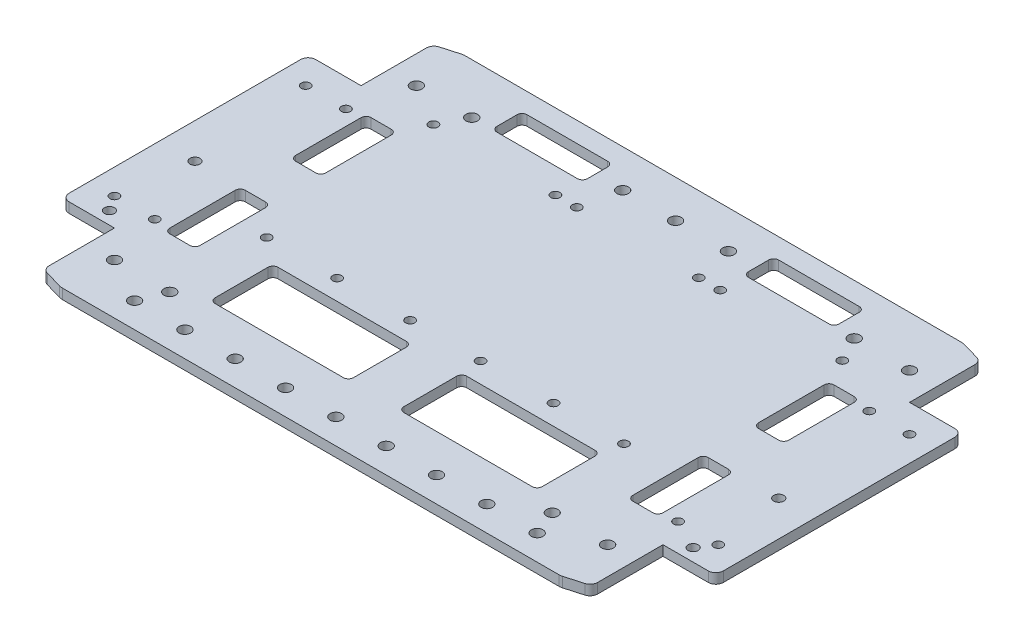
from build123d import *

# Parameters (mm, degrees)
BOSS_EXTRU_1_DEPTH         = 4
ENL_V_MAT_EXTRU_6_REACH    = 161.581
ESQUISSE15_R               = 2.3
ENL_V_MAT_EXTRU_10_REACH   = 161.581
SYM_TRIE8_COPY_1_REACH     = 161.581
ENL_V_MAT_EXTRU_12_REACH   = 161.581
ESQUISSE26_W               = 5
ESQUISSE26_H               = 98
CONG_2_R                   = 3
CONG_3_R                   = 5
ENL_V_MAT_EXTRU_16_REACH   = 154.696
ESQUISSE32_R               = 2.3
SYM_TRIE11_COPY_1_REACH    = 154.696
SYM_TRIE11_COPY_1_SKETCH_R = 2.3
ENL_V_MAT_EXTRU_17_REACH   = 154.696
ESQUISSE33_R               = 2
ENL_V_MAT_EXTRU_18_REACH   = 154.696
ESQUISSE34_R               = 2.3
ENL_V_MAT_EXTRU_21_REACH   = 154.696
ESQUISSE37_R               = 2.3
ENL_V_MAT_EXTRU_22_REACH   = 154.696
ESQUISSE39_R               = 1.8
ENL_V_MAT_EXTRU_23_REACH   = 154.696
ESQUISSE40_R               = 1.8
ENL_V_MAT_EXTRU_24_REACH   = 154.696
ESQUISSE38_W               = 55
ESQUISSE38_H               = 25
ENL_V_MAT_EXTRU_25_REACH   = 154.696
ESQUISSE41_W               = 12
ESQUISSE41_H               = 30
CONG_4_R                   = 2
ENL_V_MAT_EXTRU_26_REACH   = 154.696
CONG_5_R                   = 2


with BuildPart() as part:
    # Esquisse1 → Boss.-Extru.1 (new body)
    with BuildSketch(Plane(origin=(0, 0, 0), x_dir=(1, 0, 0), z_dir=(0, 1, 0))):
        Polygon((-135, 0), (-135, -75), (-100, -85), (0, -85), (100, -85), (135, -75), (135, 0), (135, 75), (100, 85), (0, 85), (-100, 85), (-135, 75), align=None)
    extrude(amount=BOSS_EXTRU_1_DEPTH)

    # Esquisse15 → Enlèv. mat.-Extru.6 (cut, up to next)
    with BuildSketch(Plane(origin=(0, 4, 0), x_dir=(1, 0, 0), z_dir=(0, 1, 0)), mode=Mode.PRIVATE) as enl_v_mat_extru_6_sk1:
        with Locations(Location((-120, -60, 0), (0, 0, 270))):
            Circle(ESQUISSE15_R)
    enl_v_mat_extru_6_tool1 = extrude(enl_v_mat_extru_6_sk1.sketch, amount=-ENL_V_MAT_EXTRU_6_REACH, mode=Mode.PRIVATE) & part.part
    # Esquisse15 → Enlèv. mat.-Extru.6 (cut, up to next)
    with BuildSketch(Plane(origin=(0, 4, 0), x_dir=(1, 0, 0), z_dir=(0, 1, 0)), mode=Mode.PRIVATE) as enl_v_mat_extru_6_sk2:
        with Locations(Location((-120, 60, 0), (0, 0, 270))):
            Circle(ESQUISSE15_R)
    enl_v_mat_extru_6_tool2 = extrude(enl_v_mat_extru_6_sk2.sketch, amount=-ENL_V_MAT_EXTRU_6_REACH, mode=Mode.PRIVATE) & part.part
    enl_v_mat_extru_6_1 = enl_v_mat_extru_6_tool1.solids().sort_by_distance((-120, 4, 60))[0]
    add(enl_v_mat_extru_6_1, mode=Mode.SUBTRACT)
    enl_v_mat_extru_6_2 = enl_v_mat_extru_6_tool2.solids().sort_by_distance((-120, 4, -60))[0]
    add(enl_v_mat_extru_6_2, mode=Mode.SUBTRACT)
    enl_v_mat_extru_6 = enl_v_mat_extru_6_1 + enl_v_mat_extru_6_2  # Enlèv. mat.-Extru.6 as one shape, for the pattern or mirror that repeats it

    # Symétrie5: Enlèv. mat.-Extru.6 across plane
    add(enl_v_mat_extru_6.mirror(Plane(origin=(0, 0, 0), x_dir=(0, 0, 1), z_dir=(1, 0, 0))), mode=Mode.SUBTRACT)

    # Esquisse20 → Enlèv. mat.-Extru.10 (cut, up to next)
    with BuildSketch(Plane(origin=(0, 4, 0), x_dir=(1, 0, 0), z_dir=(0, 1, 0)), mode=Mode.PRIVATE) as enl_v_mat_extru_10_sk1:
        Polygon((-109, -60), (-109, -82.428571429), (-135, -75), (-135, -49), (-109, -49), align=None)
    enl_v_mat_extru_10_tool1 = extrude(enl_v_mat_extru_10_sk1.sketch, amount=-ENL_V_MAT_EXTRU_10_REACH, mode=Mode.PRIVATE) & part.part
    enl_v_mat_extru_10 = enl_v_mat_extru_10_tool1.solids().sort_by_distance((-121.458333, 4, 63.934524))[0]
    add(enl_v_mat_extru_10, mode=Mode.SUBTRACT)

    # Symétrie7: Enlèv. mat.-Extru.10 across plane
    add(enl_v_mat_extru_10.mirror(Plane(origin=(0, 0, 0), x_dir=(0, 0, 1), z_dir=(1, 0, 0))), mode=Mode.SUBTRACT)

    # Symétrie8: Enlèv. mat.-Extru.10 across plane
    add(enl_v_mat_extru_10.mirror(Plane.XY), mode=Mode.SUBTRACT)

    # Symétrie8 copy 1 sketch → Symétrie8 copy 1 (cut, up to next)
    with BuildSketch(Plane(origin=(0, 4, 0), x_dir=(-1, 0, 0), z_dir=(0, 1, 0)), mode=Mode.PRIVATE) as sym_trie8_copy_1_sk1:
        Polygon((-109, -60), (-109, -82.428571429), (-135, -75), (-135, -49), (-109, -49), align=None)
    sym_trie8_copy_1_tool1 = extrude(sym_trie8_copy_1_sk1.sketch, amount=-SYM_TRIE8_COPY_1_REACH, mode=Mode.PRIVATE) & part.part
    add(sym_trie8_copy_1_tool1.solids().sort_by_distance((121.458333, 4, -63.934524))[0], mode=Mode.SUBTRACT)

    # Esquisse26 → Enlèv. mat.-Extru.12 (cut, up to next)
    with BuildSketch(Plane(origin=(0, 4, 0), x_dir=(1, 0, 0), z_dir=(0, 1, 0)), mode=Mode.PRIVATE) as enl_v_mat_extru_12_sk1:
        Polygon((-100, -80), (-99.299725277, -80), (-107.626394361, -77.62095169), (-109, -82.428571429), (-100, -85), align=None)
    enl_v_mat_extru_12_tool1 = extrude(enl_v_mat_extru_12_sk1.sketch, amount=-ENL_V_MAT_EXTRU_12_REACH, mode=Mode.PRIVATE) & part.part
    # Esquisse26 → Enlèv. mat.-Extru.12 (cut, up to next)
    with BuildSketch(Plane(origin=(0, 4, 0), x_dir=(1, 0, 0), z_dir=(0, 1, 0)), mode=Mode.PRIVATE) as enl_v_mat_extru_12_sk2:
        Polygon((-109, -82.428571429), (-107.626394361, -77.62095169), (-109, -77.228492936), align=None)
    enl_v_mat_extru_12_tool2 = extrude(enl_v_mat_extru_12_sk2.sketch, amount=-ENL_V_MAT_EXTRU_12_REACH, mode=Mode.PRIVATE) & part.part
    # Esquisse26 → Enlèv. mat.-Extru.12 (cut, up to next)
    with BuildSketch(Plane(origin=(0, 4, 0), x_dir=(1, 0, 0), z_dir=(0, 1, 0)), mode=Mode.PRIVATE) as enl_v_mat_extru_12_sk3:
        Polygon((98.626394361, -80.192380262), (99.299725277, -80), (-99.299725277, -80), (-98.626394361, -80.192380262), (-100, -85), (100, -85), align=None)
    enl_v_mat_extru_12_tool3 = extrude(enl_v_mat_extru_12_sk3.sketch, amount=-ENL_V_MAT_EXTRU_12_REACH, mode=Mode.PRIVATE) & part.part
    # Esquisse26 → Enlèv. mat.-Extru.12 (cut, up to next)
    with BuildSketch(Plane(origin=(0, 4, 0), x_dir=(1, 0, 0), z_dir=(0, 1, 0)), mode=Mode.PRIVATE) as enl_v_mat_extru_12_sk4:
        Polygon((109, -82.428571429), (107.626394361, -77.62095169), (99.299725277, -80), (100, -80), (100, -85), align=None)
    enl_v_mat_extru_12_tool4 = extrude(enl_v_mat_extru_12_sk4.sketch, amount=-ENL_V_MAT_EXTRU_12_REACH, mode=Mode.PRIVATE) & part.part
    # Esquisse26 → Enlèv. mat.-Extru.12 (cut, up to next)
    with BuildSketch(Plane(origin=(0, 4, 0), x_dir=(1, 0, 0), z_dir=(0, 1, 0)), mode=Mode.PRIVATE) as enl_v_mat_extru_12_sk5:
        Polygon((100, -80), (99.299725277, -80), (98.626394361, -80.192380262), (100, -85), align=None)
    enl_v_mat_extru_12_tool5 = extrude(enl_v_mat_extru_12_sk5.sketch, amount=-ENL_V_MAT_EXTRU_12_REACH, mode=Mode.PRIVATE) & part.part
    # Esquisse26 → Enlèv. mat.-Extru.12 (cut, up to next)
    with BuildSketch(Plane(origin=(0, 4, 0), x_dir=(1, 0, 0), z_dir=(0, 1, 0)), mode=Mode.PRIVATE) as enl_v_mat_extru_12_sk6:
        Polygon((109, -82.428571429), (109, -77.228492936), (107.626394361, -77.62095169), align=None)
    enl_v_mat_extru_12_tool6 = extrude(enl_v_mat_extru_12_sk6.sketch, amount=-ENL_V_MAT_EXTRU_12_REACH, mode=Mode.PRIVATE) & part.part
    # Esquisse26 → Enlèv. mat.-Extru.12 (cut, up to next)
    with BuildSketch(Plane(origin=(0, 4, 0), x_dir=(1, 0, 0), z_dir=(0, 1, 0)), mode=Mode.PRIVATE) as enl_v_mat_extru_12_sk7:
        with Locations((132.5, 0)):
            Rectangle(ESQUISSE26_W, ESQUISSE26_H)
    enl_v_mat_extru_12_tool7 = extrude(enl_v_mat_extru_12_sk7.sketch, amount=-ENL_V_MAT_EXTRU_12_REACH, mode=Mode.PRIVATE) & part.part
    # Esquisse26 → Enlèv. mat.-Extru.12 (cut, up to next)
    with BuildSketch(Plane(origin=(0, 4, 0), x_dir=(1, 0, 0), z_dir=(0, 1, 0)), mode=Mode.PRIVATE) as enl_v_mat_extru_12_sk8:
        Polygon((107.626394361, 77.62095169), (109, 82.428571429), (100, 85), (100, 80), (99.299725277, 80), align=None)
    enl_v_mat_extru_12_tool8 = extrude(enl_v_mat_extru_12_sk8.sketch, amount=-ENL_V_MAT_EXTRU_12_REACH, mode=Mode.PRIVATE) & part.part
    # Esquisse26 → Enlèv. mat.-Extru.12 (cut, up to next)
    with BuildSketch(Plane(origin=(0, 4, 0), x_dir=(1, 0, 0), z_dir=(0, 1, 0)), mode=Mode.PRIVATE) as enl_v_mat_extru_12_sk9:
        Polygon((107.626394361, 77.62095169), (109, 77.228492936), (109, 82.428571429), align=None)
    enl_v_mat_extru_12_tool9 = extrude(enl_v_mat_extru_12_sk9.sketch, amount=-ENL_V_MAT_EXTRU_12_REACH, mode=Mode.PRIVATE) & part.part
    # Esquisse26 → Enlèv. mat.-Extru.12 (cut, up to next)
    with BuildSketch(Plane(origin=(0, 4, 0), x_dir=(1, 0, 0), z_dir=(0, 1, 0)), mode=Mode.PRIVATE) as enl_v_mat_extru_12_sk10:
        Polygon((100, 80), (100, 85), (98.626394361, 80.192380262), (99.299725277, 80), align=None)
    enl_v_mat_extru_12_tool10 = extrude(enl_v_mat_extru_12_sk10.sketch, amount=-ENL_V_MAT_EXTRU_12_REACH, mode=Mode.PRIVATE) & part.part
    # Esquisse26 → Enlèv. mat.-Extru.12 (cut, up to next)
    with BuildSketch(Plane(origin=(0, 4, 0), x_dir=(1, 0, 0), z_dir=(0, 1, 0)), mode=Mode.PRIVATE) as enl_v_mat_extru_12_sk11:
        Polygon((98.626394361, 80.192380262), (100, 85), (-100, 85), (-98.626394361, 80.192380262), (-99.299725277, 80), (99.299725277, 80), align=None)
    enl_v_mat_extru_12_tool11 = extrude(enl_v_mat_extru_12_sk11.sketch, amount=-ENL_V_MAT_EXTRU_12_REACH, mode=Mode.PRIVATE) & part.part
    # Esquisse26 → Enlèv. mat.-Extru.12 (cut, up to next)
    with BuildSketch(Plane(origin=(0, 4, 0), x_dir=(1, 0, 0), z_dir=(0, 1, 0)), mode=Mode.PRIVATE) as enl_v_mat_extru_12_sk12:
        Polygon((-98.626394361, 80.192380262), (-100, 85), (-100, 80), (-99.299725277, 80), align=None)
    enl_v_mat_extru_12_tool12 = extrude(enl_v_mat_extru_12_sk12.sketch, amount=-ENL_V_MAT_EXTRU_12_REACH, mode=Mode.PRIVATE) & part.part
    # Esquisse26 → Enlèv. mat.-Extru.12 (cut, up to next)
    with BuildSketch(Plane(origin=(0, 4, 0), x_dir=(1, 0, 0), z_dir=(0, 1, 0)), mode=Mode.PRIVATE) as enl_v_mat_extru_12_sk13:
        Polygon((-100, 80), (-100, 85), (-109, 82.428571429), (-107.626394361, 77.62095169), (-99.299725277, 80), align=None)
    enl_v_mat_extru_12_tool13 = extrude(enl_v_mat_extru_12_sk13.sketch, amount=-ENL_V_MAT_EXTRU_12_REACH, mode=Mode.PRIVATE) & part.part
    # Esquisse26 → Enlèv. mat.-Extru.12 (cut, up to next)
    with BuildSketch(Plane(origin=(0, 4, 0), x_dir=(1, 0, 0), z_dir=(0, 1, 0)), mode=Mode.PRIVATE) as enl_v_mat_extru_12_sk14:
        Polygon((-107.626394361, 77.62095169), (-109, 82.428571429), (-109, 77.228492936), align=None)
    enl_v_mat_extru_12_tool14 = extrude(enl_v_mat_extru_12_sk14.sketch, amount=-ENL_V_MAT_EXTRU_12_REACH, mode=Mode.PRIVATE) & part.part
    # Esquisse26 → Enlèv. mat.-Extru.12 (cut, up to next)
    with BuildSketch(Plane(origin=(0, 4, 0), x_dir=(1, 0, 0), z_dir=(0, 1, 0)), mode=Mode.PRIVATE) as enl_v_mat_extru_12_sk15:
        with Locations((-132.5, 0)):
            Rectangle(ESQUISSE26_W, ESQUISSE26_H)
    enl_v_mat_extru_12_tool15 = extrude(enl_v_mat_extru_12_sk15.sketch, amount=-ENL_V_MAT_EXTRU_12_REACH, mode=Mode.PRIVATE) & part.part
    # Esquisse26 → Enlèv. mat.-Extru.12 (cut, up to next)
    with BuildSketch(Plane(origin=(0, 4, 0), x_dir=(1, 0, 0), z_dir=(0, 1, 0)), mode=Mode.PRIVATE) as enl_v_mat_extru_12_sk16:
        Polygon((-98.626394361, -80.192380262), (-99.299725277, -80), (-100, -80), (-100, -85), align=None)
    enl_v_mat_extru_12_tool16 = extrude(enl_v_mat_extru_12_sk16.sketch, amount=-ENL_V_MAT_EXTRU_12_REACH, mode=Mode.PRIVATE) & part.part
    add(enl_v_mat_extru_12_tool1.solids().sort_by_distance((-104.158937, 4, 81.27908))[0], mode=Mode.SUBTRACT)
    add(enl_v_mat_extru_12_tool2.solids().sort_by_distance((-108.542131, 4, 79.092672))[0], mode=Mode.SUBTRACT)
    add(enl_v_mat_extru_12_tool3.solids().sort_by_distance((0, 4, 82.505651))[0], mode=Mode.SUBTRACT)
    add(enl_v_mat_extru_12_tool4.solids().sort_by_distance((104.158937, 4, 81.27908))[0], mode=Mode.SUBTRACT)
    add(enl_v_mat_extru_12_tool5.solids().sort_by_distance((99.537641, 4, 81.69873))[0], mode=Mode.SUBTRACT)
    add(enl_v_mat_extru_12_tool6.solids().sort_by_distance((108.542131, 4, 79.092672))[0], mode=Mode.SUBTRACT)
    add(enl_v_mat_extru_12_tool7.solids().sort_by_distance((132.5, 4, 0))[0], mode=Mode.SUBTRACT)
    add(enl_v_mat_extru_12_tool8.solids().sort_by_distance((104.158937, 4, -81.27908))[0], mode=Mode.SUBTRACT)
    add(enl_v_mat_extru_12_tool9.solids().sort_by_distance((108.542131, 4, -79.092672))[0], mode=Mode.SUBTRACT)
    add(enl_v_mat_extru_12_tool10.solids().sort_by_distance((99.537641, 4, -81.69873))[0], mode=Mode.SUBTRACT)
    add(enl_v_mat_extru_12_tool11.solids().sort_by_distance((0, 4, -82.505651))[0], mode=Mode.SUBTRACT)
    add(enl_v_mat_extru_12_tool12.solids().sort_by_distance((-99.537641, 4, -81.69873))[0], mode=Mode.SUBTRACT)
    add(enl_v_mat_extru_12_tool13.solids().sort_by_distance((-104.158937, 4, -81.27908))[0], mode=Mode.SUBTRACT)
    add(enl_v_mat_extru_12_tool14.solids().sort_by_distance((-108.542131, 4, -79.092672))[0], mode=Mode.SUBTRACT)
    add(enl_v_mat_extru_12_tool15.solids().sort_by_distance((-132.5, 4, 0))[0], mode=Mode.SUBTRACT)
    add(enl_v_mat_extru_12_tool16.solids().sort_by_distance((-99.537641, 4, 81.69873))[0], mode=Mode.SUBTRACT)

    # Congé2
    cong_2_edges = [part.edges().sort_by_distance(p)[0] for p in [
        (130, 2, -49),
        (130, 2, 49),
        (109, 2, -77.228492936),
        (-109, 2, -77.228492936),
        (-130, 2, 49),
        (-130, 2, -49),
        (-109, 2, 77.228492936),
        (109, 2, 77.228492936),
    ]]
    fillet(cong_2_edges, radius=CONG_2_R)

    # Congé3
    cong_3_edges = [part.edges().sort_by_distance(p)[0] for p in [
        (99.299725277, 2, -80),
        (-99.299725277, 2, -80),
        (-99.299725277, 2, 80),
        (99.299725277, 2, 80),
    ]]
    fillet(cong_3_edges, radius=CONG_3_R)

    # Esquisse32 → Enlèv. mat.-Extru.16 (cut, up to next)
    with BuildSketch(Plane(origin=(0, 4, 0), x_dir=(1, 0, 0), z_dir=(0, 1, 0)), mode=Mode.PRIVATE) as enl_v_mat_extru_16_sk1:
        with Locations(Location((98, -60, 0), (0, 0, 270))):
            Circle(ESQUISSE32_R)
    enl_v_mat_extru_16_tool1 = extrude(enl_v_mat_extru_16_sk1.sketch, amount=-ENL_V_MAT_EXTRU_16_REACH, mode=Mode.PRIVATE) & part.part
    # Esquisse32 → Enlèv. mat.-Extru.16 (cut, up to next)
    with BuildSketch(Plane(origin=(0, 4, 0), x_dir=(1, 0, 0), z_dir=(0, 1, 0)), mode=Mode.PRIVATE) as enl_v_mat_extru_16_sk2:
        with Locations(Location((76, -60, 0), (0, 0, 270))):
            Circle(ESQUISSE32_R)
    enl_v_mat_extru_16_tool2 = extrude(enl_v_mat_extru_16_sk2.sketch, amount=-ENL_V_MAT_EXTRU_16_REACH, mode=Mode.PRIVATE) & part.part
    enl_v_mat_extru_16_1 = enl_v_mat_extru_16_tool1.solids().sort_by_distance((98, 4, 60))[0]
    add(enl_v_mat_extru_16_1, mode=Mode.SUBTRACT)
    enl_v_mat_extru_16_2 = enl_v_mat_extru_16_tool2.solids().sort_by_distance((76, 4, 60))[0]
    add(enl_v_mat_extru_16_2, mode=Mode.SUBTRACT)
    enl_v_mat_extru_16 = enl_v_mat_extru_16_1 + enl_v_mat_extru_16_2  # Enlèv. mat.-Extru.16 as one shape, for the pattern or mirror that repeats it

    # Symétrie10: Enlèv. mat.-Extru.16 across plane
    add(enl_v_mat_extru_16.mirror(Plane.XY), mode=Mode.SUBTRACT)

    # Symétrie11: Enlèv. mat.-Extru.16 across plane
    add(enl_v_mat_extru_16.mirror(Plane(origin=(0, 0, 0), x_dir=(0, 0, 1), z_dir=(1, 0, 0))), mode=Mode.SUBTRACT)

    # Symétrie11 copy 1 sketch → Symétrie11 copy 1 (cut, up to next)
    with BuildSketch(Plane(origin=(0, 4, 0), x_dir=(-1, 0, 0), z_dir=(0, 1, 0)), mode=Mode.PRIVATE) as sym_trie11_copy_1_sk1:
        with Locations(Location((98, -60, 0), (0, 0, 270))):
            Circle(SYM_TRIE11_COPY_1_SKETCH_R)
    sym_trie11_copy_1_tool1 = extrude(sym_trie11_copy_1_sk1.sketch, amount=-SYM_TRIE11_COPY_1_REACH, mode=Mode.PRIVATE) & part.part
    # Symétrie11 copy 1 sketch → Symétrie11 copy 1 (cut, up to next)
    with BuildSketch(Plane(origin=(0, 4, 0), x_dir=(-1, 0, 0), z_dir=(0, 1, 0)), mode=Mode.PRIVATE) as sym_trie11_copy_1_sk2:
        with Locations(Location((76, -60, 0), (0, 0, 270))):
            Circle(SYM_TRIE11_COPY_1_SKETCH_R)
    sym_trie11_copy_1_tool2 = extrude(sym_trie11_copy_1_sk2.sketch, amount=-SYM_TRIE11_COPY_1_REACH, mode=Mode.PRIVATE) & part.part
    add(sym_trie11_copy_1_tool1.solids().sort_by_distance((-98, 4, -60))[0], mode=Mode.SUBTRACT)
    add(sym_trie11_copy_1_tool2.solids().sort_by_distance((-76, 4, -60))[0], mode=Mode.SUBTRACT)

    # Esquisse33 → Enlèv. mat.-Extru.17 (cut, up to next)
    with BuildSketch(Plane(origin=(0, 4, 0), x_dir=(1, 0, 0), z_dir=(0, 1, 0)), mode=Mode.PRIVATE) as enl_v_mat_extru_17_sk1:
        with Locations(Location((-116, -44, 0), (0, 0, 270))):
            Circle(ESQUISSE33_R)
    enl_v_mat_extru_17_tool1 = extrude(enl_v_mat_extru_17_sk1.sketch, amount=-ENL_V_MAT_EXTRU_17_REACH, mode=Mode.PRIVATE) & part.part
    # Esquisse33 → Enlèv. mat.-Extru.17 (cut, up to next)
    with BuildSketch(Plane(origin=(0, 4, 0), x_dir=(1, 0, 0), z_dir=(0, 1, 0)), mode=Mode.PRIVATE) as enl_v_mat_extru_17_sk2:
        with Locations(Location((-116, -10, 0), (0, 0, 270))):
            Circle(ESQUISSE33_R)
    enl_v_mat_extru_17_tool2 = extrude(enl_v_mat_extru_17_sk2.sketch, amount=-ENL_V_MAT_EXTRU_17_REACH, mode=Mode.PRIVATE) & part.part
    enl_v_mat_extru_17_1 = enl_v_mat_extru_17_tool1.solids().sort_by_distance((-116, 4, 44))[0]
    add(enl_v_mat_extru_17_1, mode=Mode.SUBTRACT)
    enl_v_mat_extru_17_2 = enl_v_mat_extru_17_tool2.solids().sort_by_distance((-116, 4, 10))[0]
    add(enl_v_mat_extru_17_2, mode=Mode.SUBTRACT)
    enl_v_mat_extru_17 = enl_v_mat_extru_17_1 + enl_v_mat_extru_17_2  # Enlèv. mat.-Extru.17 as one shape, for the pattern or mirror that repeats it

    # Symétrie12: Enlèv. mat.-Extru.17 across plane
    add(enl_v_mat_extru_17.mirror(Plane(origin=(0, 0, 0), x_dir=(0, 0, 1), z_dir=(1, 0, 0))), mode=Mode.SUBTRACT)

    # Esquisse34 → Enlèv. mat.-Extru.18 (cut, up to next)
    with BuildSketch(Plane(origin=(0, 4, 0), x_dir=(1, 0, 0), z_dir=(0, 1, 0)), mode=Mode.PRIVATE) as enl_v_mat_extru_18_sk1:
        with Locations(Location((21, 65, 0), (0, 0, 270))):
            Circle(ESQUISSE34_R)
    enl_v_mat_extru_18_tool1 = extrude(enl_v_mat_extru_18_sk1.sketch, amount=-ENL_V_MAT_EXTRU_18_REACH, mode=Mode.PRIVATE) & part.part
    # Esquisse34 → Enlèv. mat.-Extru.18 (cut, up to next)
    with BuildSketch(Plane(origin=(0, 4, 0), x_dir=(1, 0, 0), z_dir=(0, 1, 0)), mode=Mode.PRIVATE) as enl_v_mat_extru_18_sk2:
        with Locations(Location((-21, 65, 0), (0, 0, 270))):
            Circle(ESQUISSE34_R)
    enl_v_mat_extru_18_tool2 = extrude(enl_v_mat_extru_18_sk2.sketch, amount=-ENL_V_MAT_EXTRU_18_REACH, mode=Mode.PRIVATE) & part.part
    # Esquisse34 → Enlèv. mat.-Extru.18 (cut, up to next)
    with BuildSketch(Plane(origin=(0, 4, 0), x_dir=(1, 0, 0), z_dir=(0, 1, 0)), mode=Mode.PRIVATE) as enl_v_mat_extru_18_sk3:
        with Locations(Location((0, 65, 0), (0, 0, 270))):
            Circle(ESQUISSE34_R)
    enl_v_mat_extru_18_tool3 = extrude(enl_v_mat_extru_18_sk3.sketch, amount=-ENL_V_MAT_EXTRU_18_REACH, mode=Mode.PRIVATE) & part.part
    add(enl_v_mat_extru_18_tool1.solids().sort_by_distance((21, 4, -65))[0], mode=Mode.SUBTRACT)
    add(enl_v_mat_extru_18_tool2.solids().sort_by_distance((-21, 4, -65))[0], mode=Mode.SUBTRACT)
    add(enl_v_mat_extru_18_tool3.solids().sort_by_distance((0, 4, -65))[0], mode=Mode.SUBTRACT)

    # Esquisse37 → Enlèv. mat.-Extru.21 (cut, up to next)
    with BuildSketch(Plane(origin=(0, 4, 0), x_dir=(1, 0, 0), z_dir=(0, 1, 0)), mode=Mode.PRIVATE) as enl_v_mat_extru_21_sk1:
        with Locations(Location((-20, -70, 0), (0, 0, 270))):
            Circle(ESQUISSE37_R)
    enl_v_mat_extru_21_tool1 = extrude(enl_v_mat_extru_21_sk1.sketch, amount=-ENL_V_MAT_EXTRU_21_REACH, mode=Mode.PRIVATE) & part.part
    # Esquisse37 → Enlèv. mat.-Extru.21 (cut, up to next)
    with BuildSketch(Plane(origin=(0, 4, 0), x_dir=(1, 0, 0), z_dir=(0, 1, 0)), mode=Mode.PRIVATE) as enl_v_mat_extru_21_sk2:
        with Locations(Location((-40, -70, 0), (0, 0, 270))):
            Circle(ESQUISSE37_R)
    enl_v_mat_extru_21_tool2 = extrude(enl_v_mat_extru_21_sk2.sketch, amount=-ENL_V_MAT_EXTRU_21_REACH, mode=Mode.PRIVATE) & part.part
    # Esquisse37 → Enlèv. mat.-Extru.21 (cut, up to next)
    with BuildSketch(Plane(origin=(0, 4, 0), x_dir=(1, 0, 0), z_dir=(0, 1, 0)), mode=Mode.PRIVATE) as enl_v_mat_extru_21_sk3:
        with Locations(Location((-60, -70, 0), (0, 0, 270))):
            Circle(ESQUISSE37_R)
    enl_v_mat_extru_21_tool3 = extrude(enl_v_mat_extru_21_sk3.sketch, amount=-ENL_V_MAT_EXTRU_21_REACH, mode=Mode.PRIVATE) & part.part
    # Esquisse37 → Enlèv. mat.-Extru.21 (cut, up to next)
    with BuildSketch(Plane(origin=(0, 4, 0), x_dir=(1, 0, 0), z_dir=(0, 1, 0)), mode=Mode.PRIVATE) as enl_v_mat_extru_21_sk4:
        with Locations(Location((-80, -70, 0), (0, 0, 270))):
            Circle(ESQUISSE37_R)
    enl_v_mat_extru_21_tool4 = extrude(enl_v_mat_extru_21_sk4.sketch, amount=-ENL_V_MAT_EXTRU_21_REACH, mode=Mode.PRIVATE) & part.part
    # Esquisse37 → Enlèv. mat.-Extru.21 (cut, up to next)
    with BuildSketch(Plane(origin=(0, 4, 0), x_dir=(1, 0, 0), z_dir=(0, 1, 0)), mode=Mode.PRIVATE) as enl_v_mat_extru_21_sk5:
        with Locations(Location((80, -70, 0), (0, 0, 270))):
            Circle(ESQUISSE37_R)
    enl_v_mat_extru_21_tool5 = extrude(enl_v_mat_extru_21_sk5.sketch, amount=-ENL_V_MAT_EXTRU_21_REACH, mode=Mode.PRIVATE) & part.part
    # Esquisse37 → Enlèv. mat.-Extru.21 (cut, up to next)
    with BuildSketch(Plane(origin=(0, 4, 0), x_dir=(1, 0, 0), z_dir=(0, 1, 0)), mode=Mode.PRIVATE) as enl_v_mat_extru_21_sk6:
        with Locations(Location((60, -70, 0), (0, 0, 270))):
            Circle(ESQUISSE37_R)
    enl_v_mat_extru_21_tool6 = extrude(enl_v_mat_extru_21_sk6.sketch, amount=-ENL_V_MAT_EXTRU_21_REACH, mode=Mode.PRIVATE) & part.part
    # Esquisse37 → Enlèv. mat.-Extru.21 (cut, up to next)
    with BuildSketch(Plane(origin=(0, 4, 0), x_dir=(1, 0, 0), z_dir=(0, 1, 0)), mode=Mode.PRIVATE) as enl_v_mat_extru_21_sk7:
        with Locations(Location((40, -70, 0), (0, 0, 270))):
            Circle(ESQUISSE37_R)
    enl_v_mat_extru_21_tool7 = extrude(enl_v_mat_extru_21_sk7.sketch, amount=-ENL_V_MAT_EXTRU_21_REACH, mode=Mode.PRIVATE) & part.part
    # Esquisse37 → Enlèv. mat.-Extru.21 (cut, up to next)
    with BuildSketch(Plane(origin=(0, 4, 0), x_dir=(1, 0, 0), z_dir=(0, 1, 0)), mode=Mode.PRIVATE) as enl_v_mat_extru_21_sk8:
        with Locations(Location((20, -70, 0), (0, 0, 270))):
            Circle(ESQUISSE37_R)
    enl_v_mat_extru_21_tool8 = extrude(enl_v_mat_extru_21_sk8.sketch, amount=-ENL_V_MAT_EXTRU_21_REACH, mode=Mode.PRIVATE) & part.part
    # Esquisse37 → Enlèv. mat.-Extru.21 (cut, up to next)
    with BuildSketch(Plane(origin=(0, 4, 0), x_dir=(1, 0, 0), z_dir=(0, 1, 0)), mode=Mode.PRIVATE) as enl_v_mat_extru_21_sk9:
        with Locations(Location((0, -70, 0), (0, 0, 270))):
            Circle(ESQUISSE37_R)
    enl_v_mat_extru_21_tool9 = extrude(enl_v_mat_extru_21_sk9.sketch, amount=-ENL_V_MAT_EXTRU_21_REACH, mode=Mode.PRIVATE) & part.part
    add(enl_v_mat_extru_21_tool1.solids().sort_by_distance((-20, 4, 70))[0], mode=Mode.SUBTRACT)
    add(enl_v_mat_extru_21_tool2.solids().sort_by_distance((-40, 4, 70))[0], mode=Mode.SUBTRACT)
    add(enl_v_mat_extru_21_tool3.solids().sort_by_distance((-60, 4, 70))[0], mode=Mode.SUBTRACT)
    add(enl_v_mat_extru_21_tool4.solids().sort_by_distance((-80, 4, 70))[0], mode=Mode.SUBTRACT)
    add(enl_v_mat_extru_21_tool5.solids().sort_by_distance((80, 4, 70))[0], mode=Mode.SUBTRACT)
    add(enl_v_mat_extru_21_tool6.solids().sort_by_distance((60, 4, 70))[0], mode=Mode.SUBTRACT)
    add(enl_v_mat_extru_21_tool7.solids().sort_by_distance((40, 4, 70))[0], mode=Mode.SUBTRACT)
    add(enl_v_mat_extru_21_tool8.solids().sort_by_distance((20, 4, 70))[0], mode=Mode.SUBTRACT)
    add(enl_v_mat_extru_21_tool9.solids().sort_by_distance((0, 4, 70))[0], mode=Mode.SUBTRACT)

    # Esquisse39 → Enlèv. mat.-Extru.22 (cut, up to next)
    with BuildSketch(Plane(origin=(0, 4, 0), x_dir=(1, 0, 0), z_dir=(0, 1, 0)), mode=Mode.PRIVATE) as enl_v_mat_extru_22_sk1:
        with Locations(Location((-120, 38, 0), (0, 0, 270))):
            Circle(ESQUISSE39_R)
    enl_v_mat_extru_22_tool1 = extrude(enl_v_mat_extru_22_sk1.sketch, amount=-ENL_V_MAT_EXTRU_22_REACH, mode=Mode.PRIVATE) & part.part
    # Esquisse39 → Enlèv. mat.-Extru.22 (cut, up to next)
    with BuildSketch(Plane(origin=(0, 4, 0), x_dir=(1, 0, 0), z_dir=(0, 1, 0)), mode=Mode.PRIVATE) as enl_v_mat_extru_22_sk2:
        with Locations(Location((-104, 38, 0), (0, 0, 270))):
            Circle(ESQUISSE39_R)
    enl_v_mat_extru_22_tool2 = extrude(enl_v_mat_extru_22_sk2.sketch, amount=-ENL_V_MAT_EXTRU_22_REACH, mode=Mode.PRIVATE) & part.part
    # Esquisse39 → Enlèv. mat.-Extru.22 (cut, up to next)
    with BuildSketch(Plane(origin=(0, 4, 0), x_dir=(1, 0, 0), z_dir=(0, 1, 0)), mode=Mode.PRIVATE) as enl_v_mat_extru_22_sk3:
        with Locations(Location((-104, -38, 0), (0, 0, 270))):
            Circle(ESQUISSE39_R)
    enl_v_mat_extru_22_tool3 = extrude(enl_v_mat_extru_22_sk3.sketch, amount=-ENL_V_MAT_EXTRU_22_REACH, mode=Mode.PRIVATE) & part.part
    # Esquisse39 → Enlèv. mat.-Extru.22 (cut, up to next)
    with BuildSketch(Plane(origin=(0, 4, 0), x_dir=(1, 0, 0), z_dir=(0, 1, 0)), mode=Mode.PRIVATE) as enl_v_mat_extru_22_sk4:
        with Locations(Location((-120, -38, 0), (0, 0, 270))):
            Circle(ESQUISSE39_R)
    enl_v_mat_extru_22_tool4 = extrude(enl_v_mat_extru_22_sk4.sketch, amount=-ENL_V_MAT_EXTRU_22_REACH, mode=Mode.PRIVATE) & part.part
    # Esquisse39 → Enlèv. mat.-Extru.22 (cut, up to next)
    with BuildSketch(Plane(origin=(0, 4, 0), x_dir=(1, 0, 0), z_dir=(0, 1, 0)), mode=Mode.PRIVATE) as enl_v_mat_extru_22_sk5:
        with Locations(Location((120, -38, 0), (0, 0, 270))):
            Circle(ESQUISSE39_R)
    enl_v_mat_extru_22_tool5 = extrude(enl_v_mat_extru_22_sk5.sketch, amount=-ENL_V_MAT_EXTRU_22_REACH, mode=Mode.PRIVATE) & part.part
    # Esquisse39 → Enlèv. mat.-Extru.22 (cut, up to next)
    with BuildSketch(Plane(origin=(0, 4, 0), x_dir=(1, 0, 0), z_dir=(0, 1, 0)), mode=Mode.PRIVATE) as enl_v_mat_extru_22_sk6:
        with Locations(Location((104, -38, 0), (0, 0, 270))):
            Circle(ESQUISSE39_R)
    enl_v_mat_extru_22_tool6 = extrude(enl_v_mat_extru_22_sk6.sketch, amount=-ENL_V_MAT_EXTRU_22_REACH, mode=Mode.PRIVATE) & part.part
    # Esquisse39 → Enlèv. mat.-Extru.22 (cut, up to next)
    with BuildSketch(Plane(origin=(0, 4, 0), x_dir=(1, 0, 0), z_dir=(0, 1, 0)), mode=Mode.PRIVATE) as enl_v_mat_extru_22_sk7:
        with Locations(Location((104, 38, 0), (0, 0, 270))):
            Circle(ESQUISSE39_R)
    enl_v_mat_extru_22_tool7 = extrude(enl_v_mat_extru_22_sk7.sketch, amount=-ENL_V_MAT_EXTRU_22_REACH, mode=Mode.PRIVATE) & part.part
    # Esquisse39 → Enlèv. mat.-Extru.22 (cut, up to next)
    with BuildSketch(Plane(origin=(0, 4, 0), x_dir=(1, 0, 0), z_dir=(0, 1, 0)), mode=Mode.PRIVATE) as enl_v_mat_extru_22_sk8:
        with Locations(Location((120, 38, 0), (0, 0, 270))):
            Circle(ESQUISSE39_R)
    enl_v_mat_extru_22_tool8 = extrude(enl_v_mat_extru_22_sk8.sketch, amount=-ENL_V_MAT_EXTRU_22_REACH, mode=Mode.PRIVATE) & part.part
    add(enl_v_mat_extru_22_tool1.solids().sort_by_distance((-120, 4, -38))[0], mode=Mode.SUBTRACT)
    add(enl_v_mat_extru_22_tool2.solids().sort_by_distance((-104, 4, -38))[0], mode=Mode.SUBTRACT)
    add(enl_v_mat_extru_22_tool3.solids().sort_by_distance((-104, 4, 38))[0], mode=Mode.SUBTRACT)
    add(enl_v_mat_extru_22_tool4.solids().sort_by_distance((-120, 4, 38))[0], mode=Mode.SUBTRACT)
    add(enl_v_mat_extru_22_tool5.solids().sort_by_distance((120, 4, 38))[0], mode=Mode.SUBTRACT)
    add(enl_v_mat_extru_22_tool6.solids().sort_by_distance((104, 4, 38))[0], mode=Mode.SUBTRACT)
    add(enl_v_mat_extru_22_tool7.solids().sort_by_distance((104, 4, -38))[0], mode=Mode.SUBTRACT)
    add(enl_v_mat_extru_22_tool8.solids().sort_by_distance((120, 4, -38))[0], mode=Mode.SUBTRACT)

    # Esquisse40 → Enlèv. mat.-Extru.23 (cut, up to next)
    with BuildSketch(Plane(origin=(0, 4, 0), x_dir=(1, 0, 0), z_dir=(0, 1, 0)), mode=Mode.PRIVATE) as enl_v_mat_extru_23_sk1:
        with Locations(Location((24.25, 50, 0), (0, 0, 270))):
            Circle(ESQUISSE40_R)
    enl_v_mat_extru_23_tool1 = extrude(enl_v_mat_extru_23_sk1.sketch, amount=-ENL_V_MAT_EXTRU_23_REACH, mode=Mode.PRIVATE) & part.part
    # Esquisse40 → Enlèv. mat.-Extru.23 (cut, up to next)
    with BuildSketch(Plane(origin=(0, 4, 0), x_dir=(1, 0, 0), z_dir=(0, 1, 0)), mode=Mode.PRIVATE) as enl_v_mat_extru_23_sk2:
        with Locations(Location((32.75, 50, 0), (0, 0, 270))):
            Circle(ESQUISSE40_R)
    enl_v_mat_extru_23_tool2 = extrude(enl_v_mat_extru_23_sk2.sketch, amount=-ENL_V_MAT_EXTRU_23_REACH, mode=Mode.PRIVATE) & part.part
    # Esquisse40 → Enlèv. mat.-Extru.23 (cut, up to next)
    with BuildSketch(Plane(origin=(0, 4, 0), x_dir=(1, 0, 0), z_dir=(0, 1, 0)), mode=Mode.PRIVATE) as enl_v_mat_extru_23_sk3:
        with Locations(Location((81.25, 50, 0), (0, 0, 270))):
            Circle(ESQUISSE40_R)
    enl_v_mat_extru_23_tool3 = extrude(enl_v_mat_extru_23_sk3.sketch, amount=-ENL_V_MAT_EXTRU_23_REACH, mode=Mode.PRIVATE) & part.part
    # Esquisse40 → Enlèv. mat.-Extru.23 (cut, up to next)
    with BuildSketch(Plane(origin=(0, 4, 0), x_dir=(1, 0, 0), z_dir=(0, 1, 0)), mode=Mode.PRIVATE) as enl_v_mat_extru_23_sk4:
        with Locations(Location((-81.25, 50, 0), (0, 0, 270))):
            Circle(ESQUISSE40_R)
    enl_v_mat_extru_23_tool4 = extrude(enl_v_mat_extru_23_sk4.sketch, amount=-ENL_V_MAT_EXTRU_23_REACH, mode=Mode.PRIVATE) & part.part
    # Esquisse40 → Enlèv. mat.-Extru.23 (cut, up to next)
    with BuildSketch(Plane(origin=(0, 4, 0), x_dir=(1, 0, 0), z_dir=(0, 1, 0)), mode=Mode.PRIVATE) as enl_v_mat_extru_23_sk5:
        with Locations(Location((-32.75, 50, 0), (0, 0, 270))):
            Circle(ESQUISSE40_R)
    enl_v_mat_extru_23_tool5 = extrude(enl_v_mat_extru_23_sk5.sketch, amount=-ENL_V_MAT_EXTRU_23_REACH, mode=Mode.PRIVATE) & part.part
    # Esquisse40 → Enlèv. mat.-Extru.23 (cut, up to next)
    with BuildSketch(Plane(origin=(0, 4, 0), x_dir=(1, 0, 0), z_dir=(0, 1, 0)), mode=Mode.PRIVATE) as enl_v_mat_extru_23_sk6:
        with Locations(Location((-24.25, 50, 0), (0, 0, 270))):
            Circle(ESQUISSE40_R)
    enl_v_mat_extru_23_tool6 = extrude(enl_v_mat_extru_23_sk6.sketch, amount=-ENL_V_MAT_EXTRU_23_REACH, mode=Mode.PRIVATE) & part.part
    # Esquisse40 → Enlèv. mat.-Extru.23 (cut, up to next)
    with BuildSketch(Plane(origin=(0, 4, 0), x_dir=(1, 0, 0), z_dir=(0, 1, 0)), mode=Mode.PRIVATE) as enl_v_mat_extru_23_sk7:
        with Locations(Location((-75.5, -22, 0), (0, 0, 270))):
            Circle(ESQUISSE40_R)
    enl_v_mat_extru_23_tool7 = extrude(enl_v_mat_extru_23_sk7.sketch, amount=-ENL_V_MAT_EXTRU_23_REACH, mode=Mode.PRIVATE) & part.part
    # Esquisse40 → Enlèv. mat.-Extru.23 (cut, up to next)
    with BuildSketch(Plane(origin=(0, 4, 0), x_dir=(1, 0, 0), z_dir=(0, 1, 0)), mode=Mode.PRIVATE) as enl_v_mat_extru_23_sk8:
        with Locations(Location((-47.5, -22, 0), (0, 0, 270))):
            Circle(ESQUISSE40_R)
    enl_v_mat_extru_23_tool8 = extrude(enl_v_mat_extru_23_sk8.sketch, amount=-ENL_V_MAT_EXTRU_23_REACH, mode=Mode.PRIVATE) & part.part
    # Esquisse40 → Enlèv. mat.-Extru.23 (cut, up to next)
    with BuildSketch(Plane(origin=(0, 4, 0), x_dir=(1, 0, 0), z_dir=(0, 1, 0)), mode=Mode.PRIVATE) as enl_v_mat_extru_23_sk9:
        with Locations(Location((-18.5, -22, 0), (0, 0, 270))):
            Circle(ESQUISSE40_R)
    enl_v_mat_extru_23_tool9 = extrude(enl_v_mat_extru_23_sk9.sketch, amount=-ENL_V_MAT_EXTRU_23_REACH, mode=Mode.PRIVATE) & part.part
    # Esquisse40 → Enlèv. mat.-Extru.23 (cut, up to next)
    with BuildSketch(Plane(origin=(0, 4, 0), x_dir=(1, 0, 0), z_dir=(0, 1, 0)), mode=Mode.PRIVATE) as enl_v_mat_extru_23_sk10:
        with Locations(Location((9.5, -22, 0), (0, 0, 270))):
            Circle(ESQUISSE40_R)
    enl_v_mat_extru_23_tool10 = extrude(enl_v_mat_extru_23_sk10.sketch, amount=-ENL_V_MAT_EXTRU_23_REACH, mode=Mode.PRIVATE) & part.part
    # Esquisse40 → Enlèv. mat.-Extru.23 (cut, up to next)
    with BuildSketch(Plane(origin=(0, 4, 0), x_dir=(1, 0, 0), z_dir=(0, 1, 0)), mode=Mode.PRIVATE) as enl_v_mat_extru_23_sk11:
        with Locations(Location((38.5, -22, 0), (0, 0, 270))):
            Circle(ESQUISSE40_R)
    enl_v_mat_extru_23_tool11 = extrude(enl_v_mat_extru_23_sk11.sketch, amount=-ENL_V_MAT_EXTRU_23_REACH, mode=Mode.PRIVATE) & part.part
    # Esquisse40 → Enlèv. mat.-Extru.23 (cut, up to next)
    with BuildSketch(Plane(origin=(0, 4, 0), x_dir=(1, 0, 0), z_dir=(0, 1, 0)), mode=Mode.PRIVATE) as enl_v_mat_extru_23_sk12:
        with Locations(Location((66.5, -22, 0), (0, 0, 270))):
            Circle(ESQUISSE40_R)
    enl_v_mat_extru_23_tool12 = extrude(enl_v_mat_extru_23_sk12.sketch, amount=-ENL_V_MAT_EXTRU_23_REACH, mode=Mode.PRIVATE) & part.part
    add(enl_v_mat_extru_23_tool1.solids().sort_by_distance((24.25, 4, -50))[0], mode=Mode.SUBTRACT)
    add(enl_v_mat_extru_23_tool2.solids().sort_by_distance((32.75, 4, -50))[0], mode=Mode.SUBTRACT)
    add(enl_v_mat_extru_23_tool3.solids().sort_by_distance((81.25, 4, -50))[0], mode=Mode.SUBTRACT)
    add(enl_v_mat_extru_23_tool4.solids().sort_by_distance((-81.25, 4, -50))[0], mode=Mode.SUBTRACT)
    add(enl_v_mat_extru_23_tool5.solids().sort_by_distance((-32.75, 4, -50))[0], mode=Mode.SUBTRACT)
    add(enl_v_mat_extru_23_tool6.solids().sort_by_distance((-24.25, 4, -50))[0], mode=Mode.SUBTRACT)
    add(enl_v_mat_extru_23_tool7.solids().sort_by_distance((-75.5, 4, 22))[0], mode=Mode.SUBTRACT)
    add(enl_v_mat_extru_23_tool8.solids().sort_by_distance((-47.5, 4, 22))[0], mode=Mode.SUBTRACT)
    add(enl_v_mat_extru_23_tool9.solids().sort_by_distance((-18.5, 4, 22))[0], mode=Mode.SUBTRACT)
    add(enl_v_mat_extru_23_tool10.solids().sort_by_distance((9.5, 4, 22))[0], mode=Mode.SUBTRACT)
    add(enl_v_mat_extru_23_tool11.solids().sort_by_distance((38.5, 4, 22))[0], mode=Mode.SUBTRACT)
    add(enl_v_mat_extru_23_tool12.solids().sort_by_distance((66.5, 4, 22))[0], mode=Mode.SUBTRACT)

    # Esquisse38 → Enlèv. mat.-Extru.24 (cut, up to next)
    with BuildSketch(Plane(origin=(0, 4, 0), x_dir=(1, 0, 0), z_dir=(0, 1, 0)), mode=Mode.PRIVATE) as enl_v_mat_extru_24_sk1:
        with Locations((-37.5, -42.5)):
            Rectangle(ESQUISSE38_W, ESQUISSE38_H)
    enl_v_mat_extru_24_tool1 = extrude(enl_v_mat_extru_24_sk1.sketch, amount=-ENL_V_MAT_EXTRU_24_REACH, mode=Mode.PRIVATE) & part.part
    # Esquisse38 → Enlèv. mat.-Extru.24 (cut, up to next)
    with BuildSketch(Plane(origin=(0, 4, 0), x_dir=(1, 0, 0), z_dir=(0, 1, 0)), mode=Mode.PRIVATE) as enl_v_mat_extru_24_sk2:
        with Locations((37.5, -42.5)):
            Rectangle(ESQUISSE38_W, ESQUISSE38_H)
    enl_v_mat_extru_24_tool2 = extrude(enl_v_mat_extru_24_sk2.sketch, amount=-ENL_V_MAT_EXTRU_24_REACH, mode=Mode.PRIVATE) & part.part
    add(enl_v_mat_extru_24_tool1.solids().sort_by_distance((-37.5, 4, 42.5))[0], mode=Mode.SUBTRACT)
    add(enl_v_mat_extru_24_tool2.solids().sort_by_distance((37.5, 4, 42.5))[0], mode=Mode.SUBTRACT)

    # Esquisse41 → Enlèv. mat.-Extru.25 (cut, up to next)
    with BuildSketch(Plane(origin=(0, 4, 0), x_dir=(1, 0, 0), z_dir=(0, 1, 0)), mode=Mode.PRIVATE) as enl_v_mat_extru_25_sk1:
        with Locations((-92, 25)):
            Rectangle(ESQUISSE41_W, ESQUISSE41_H)
    enl_v_mat_extru_25_tool1 = extrude(enl_v_mat_extru_25_sk1.sketch, amount=-ENL_V_MAT_EXTRU_25_REACH, mode=Mode.PRIVATE) & part.part
    # Esquisse41 → Enlèv. mat.-Extru.25 (cut, up to next)
    with BuildSketch(Plane(origin=(0, 4, 0), x_dir=(1, 0, 0), z_dir=(0, 1, 0)), mode=Mode.PRIVATE) as enl_v_mat_extru_25_sk2:
        with Locations((-92, -25)):
            Rectangle(ESQUISSE41_W, ESQUISSE41_H)
    enl_v_mat_extru_25_tool2 = extrude(enl_v_mat_extru_25_sk2.sketch, amount=-ENL_V_MAT_EXTRU_25_REACH, mode=Mode.PRIVATE) & part.part
    enl_v_mat_extru_25_1 = enl_v_mat_extru_25_tool1.solids().sort_by_distance((-92, 4, -25))[0]
    add(enl_v_mat_extru_25_1, mode=Mode.SUBTRACT)
    enl_v_mat_extru_25_2 = enl_v_mat_extru_25_tool2.solids().sort_by_distance((-92, 4, 25))[0]
    add(enl_v_mat_extru_25_2, mode=Mode.SUBTRACT)
    enl_v_mat_extru_25 = enl_v_mat_extru_25_1 + enl_v_mat_extru_25_2  # Enlèv. mat.-Extru.25 as one shape, for the pattern or mirror that repeats it

    # Symétrie13: Enlèv. mat.-Extru.25 across plane
    add(enl_v_mat_extru_25.mirror(Plane(origin=(0, 0, 0), x_dir=(0, 0, 1), z_dir=(1, 0, 0))), mode=Mode.SUBTRACT)

    # Congé4
    cong_4_edges = [part.edges().sort_by_distance(p)[0] for p in [
        (-10, 2, 55),
        (-65, 2, 55),
        (-65, 2, 30),
        (-10, 2, 30),
        (10, 2, 55),
        (10, 2, 30),
        (65, 2, 30),
        (65, 2, 55),
        (-98, 2, -10),
        (-98, 2, -40),
        (-86, 2, -40),
        (-86, 2, -10),
        (-98, 2, 10),
        (-86, 2, 10),
        (-86, 2, 40),
        (-98, 2, 40),
        (98, 2, -40),
        (98, 2, -10),
        (86, 2, -10),
        (86, 2, -40),
        (86, 2, 10),
        (98, 2, 10),
        (98, 2, 40),
        (86, 2, 40),
    ]]
    fillet(cong_4_edges, radius=CONG_4_R)

    # Esquisse42 → Enlèv. mat.-Extru.26 (cut, up to next)
    with BuildSketch(Plane(origin=(0, 4, 0), x_dir=(1, 0, 0), z_dir=(0, 1, 0)), mode=Mode.PRIVATE) as enl_v_mat_extru_26_sk1:
        Polygon((-50, 60), (-32, 60), (-32, 72), (-68, 72), (-68, 60), align=None)
    enl_v_mat_extru_26_tool1 = extrude(enl_v_mat_extru_26_sk1.sketch, amount=-ENL_V_MAT_EXTRU_26_REACH, mode=Mode.PRIVATE) & part.part
    # Esquisse42 → Enlèv. mat.-Extru.26 (cut, up to next)
    with BuildSketch(Plane(origin=(0, 4, 0), x_dir=(1, 0, 0), z_dir=(0, 1, 0)), mode=Mode.PRIVATE) as enl_v_mat_extru_26_sk2:
        Polygon((32, 72), (32, 60), (50, 60), (68, 60), (68, 72), align=None)
    enl_v_mat_extru_26_tool2 = extrude(enl_v_mat_extru_26_sk2.sketch, amount=-ENL_V_MAT_EXTRU_26_REACH, mode=Mode.PRIVATE) & part.part
    add(enl_v_mat_extru_26_tool1.solids().sort_by_distance((-50, 4, -66))[0], mode=Mode.SUBTRACT)
    add(enl_v_mat_extru_26_tool2.solids().sort_by_distance((50, 4, -66))[0], mode=Mode.SUBTRACT)

    # Congé5
    cong_5_edges = [part.edges().sort_by_distance(p)[0] for p in [
        (32, 2, -60),
        (32, 2, -72),
        (68, 2, -72),
        (68, 2, -60),
        (-32, 2, -72),
        (-32, 2, -60),
        (-68, 2, -60),
        (-68, 2, -72),
    ]]
    fillet(cong_5_edges, radius=CONG_5_R)


solid = part.part
